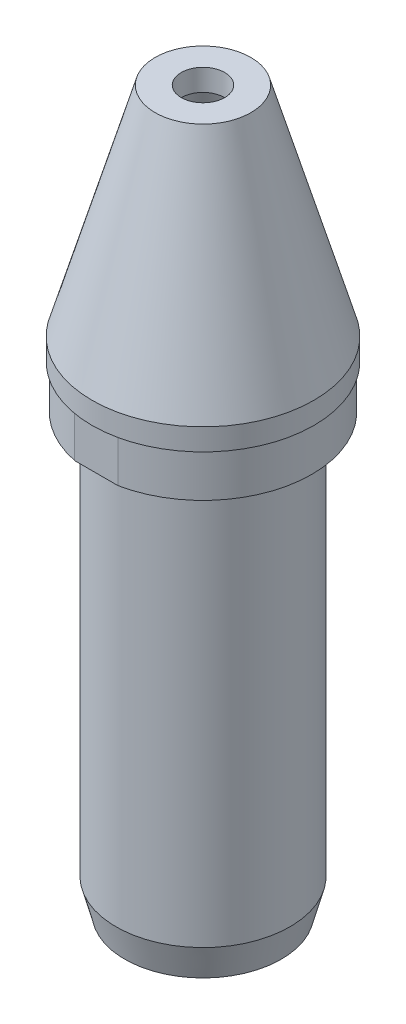
from build123d import *

# Parameters (mm, degrees)
CROQUIS2_W            = 5
CROQUIS2_H            = 0.1
CORTAR_EXTRUIR1_DEPTH = 1


with BuildPart() as part:
    # Croquis1 → Revolución1 (revolve)
    with BuildSketch(Plane.XY, mode=Mode.PRIVATE) as revoluci_n1_sk:
        Polygon((1.05, 10), (1.8, 10), (1.8, 0), (2, 0.746410162), (2, 10), (2.5, 10), (2.5, 11), (2.55, 11), (2.55, 11.5), (1.1, 16.5), (0.5, 16.5), (0.5, 16), (0.724399385, 16), (2, 11.5), (2, 10.5), (1.5, 10.5), (1.05, 10.5), align=None)
    revolve(revoluci_n1_sk.sketch.rotate(Axis((0, 0, 0), (0, 1, 0)), 90), axis=Axis((0, 0, 0), (0, 1, 0)))

    # Croquis2 → Cortar-Extruir1 (cut)
    with BuildSketch(Plane.XZ.offset(-10)):
        with Locations((0, 2.5)):
            Rectangle(CROQUIS2_W, CROQUIS2_H)
        with Locations((0, -2.5)):
            Rectangle(CROQUIS2_W, CROQUIS2_H)
    extrude(amount=-CORTAR_EXTRUIR1_DEPTH, mode=Mode.SUBTRACT)


solid = part.part
